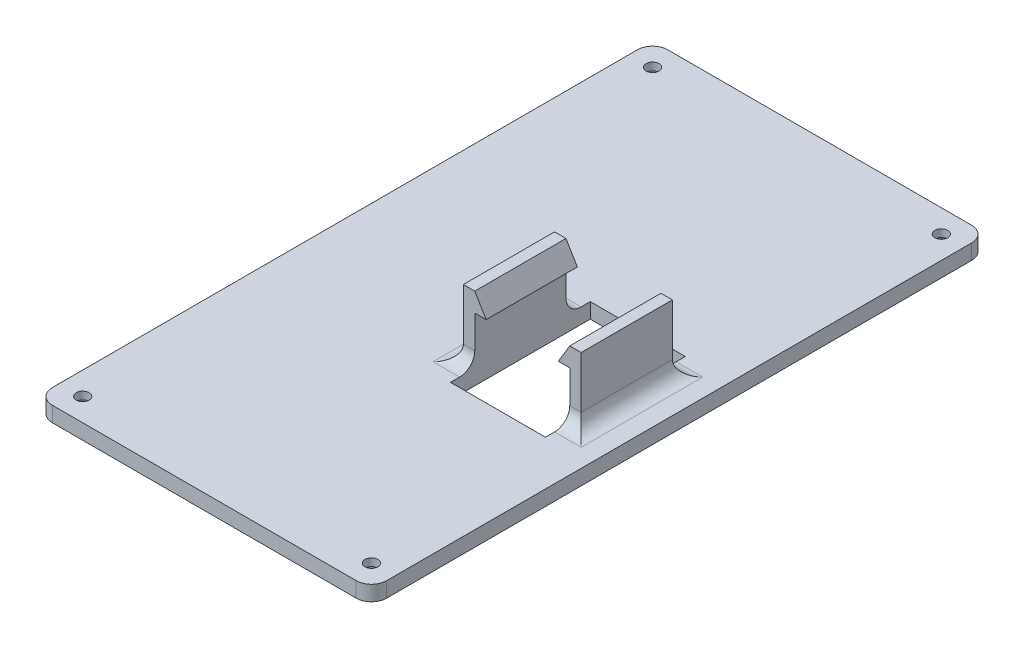
from build123d import *

# Parameters (mm, degrees)
SKETCH_1_W          = 44
SKETCH_1_H          = 81
EXTRUDE_1_DEPTH     = 2
SKETCH_12_W         = 12.5
SKETCH_12_H         = 18.4
CUT_EXTRUDE_3_DEPTH = 7.5
SKETCH_15_W         = 1.5
SKETCH_15_H         = 12
EXTRUDE_10_DEPTH    = 8.8
EXTRUDE_11_DEPTH    = 12
EXTRUDE_12_DEPTH    = 12
FILLET_2_R          = 2
FILLET_3_R          = 2
SKETCH_19_R         = 0.85
CUT_EXTRUDE_4_DEPTH = 12
SKETCH_20_R         = 2
CUT_EXTRUDE_5_DEPTH = 1


with BuildPart() as part:
    # 草图1 → 凸台-拉伸1 (new body)
    with BuildSketch(Plane(origin=(0, 0, 0), x_dir=(1, 0, 0), z_dir=(0, 1, 0))):
        with Locations((0, 2.5)):
            Rectangle(SKETCH_1_W, SKETCH_1_H)
    extrude(amount=EXTRUDE_1_DEPTH)

    # 草图12 → 切除-拉伸3 (cut)
    with BuildSketch(Plane.XZ):
        with Locations((9.849848709, 0)):
            Rectangle(SKETCH_12_W, SKETCH_12_H)
    extrude(amount=-CUT_EXTRUDE_3_DEPTH, mode=Mode.SUBTRACT)

    # 草图15 → 凸台-拉伸10 (add)
    with BuildSketch(Plane(origin=(0, 2, 0), x_dir=(1, 0, 0), z_dir=(0, 1, 0))):
        with Locations((2.849848709, 0)):
            Rectangle(SKETCH_15_W, SKETCH_15_H)
        with Locations((16.849848709, 0)):
            Rectangle(SKETCH_15_W, SKETCH_15_H)
    extrude(amount=EXTRUDE_10_DEPTH)

    # 草图16 → 凸台-拉伸11 (add)
    with BuildSketch(Plane.XY.offset(6)):
        Polygon((3.599848709, 10.8), (5.099848709, 8.3), (3.599848709, 8.3), align=None)
    extrude(amount=-EXTRUDE_11_DEPTH)

    # 草图18 → 凸台-拉伸12 (add)
    with BuildSketch(Plane.XY.offset(6)):
        Polygon((16.099848709, 10.8), (14.599848709, 8.3), (16.099848709, 8.3), align=None)
    extrude(amount=-EXTRUDE_12_DEPTH)

    # 圆角2
    fillet_2_edges = [part.edges().sort_by_distance(p)[0] for p in [
        (2.849848709, 2, -6),
        (2.099848709, 2, 0),
        (2.849848709, 2, 6),
        (16.849848709, 2, -6),
        (16.849848709, 2, 6),
        (17.599848709, 2, 0),
    ]]
    fillet(fillet_2_edges, radius=FILLET_2_R)

    # 圆角3
    fillet_3_edges = [part.edges().sort_by_distance(p)[0] for p in [
        (-22, 1, -43),
        (22, 1, -43),
        (22, 1, 38),
        (-22, 1, 38),
    ]]
    fillet(fillet_3_edges, radius=FILLET_3_R)

    # 草图19 → 切除-拉伸4 (cut)
    with BuildSketch(Plane(origin=(0, 2, 0), x_dir=(1, 0, 0), z_dir=(0, 1, 0))):
        with Locations(Location((-19, 40, 0), (0, 0, 270))):
            Circle(SKETCH_19_R)
        with Locations(Location((19, 40, 0), (0, 0, 270))):
            Circle(SKETCH_19_R)
        with Locations(Location((19, -35, 0), (0, 0, 270))):
            Circle(SKETCH_19_R)
        with Locations(Location((-19, -35, 0), (0, 0, 270))):
            Circle(SKETCH_19_R)
    extrude(amount=-CUT_EXTRUDE_4_DEPTH, mode=Mode.SUBTRACT)

    # 草图20 → 切除-拉伸5 (cut)
    with BuildSketch(Plane.XZ):
        with Locations(Location((-19, 35, 0), (0, 0, 270))):
            Circle(SKETCH_20_R)
        with Locations(Location((19, 35, 0), (0, 0, 270))):
            Circle(SKETCH_20_R)
        with Locations(Location((-19, -40, 0), (0, 0, 270))):
            Circle(SKETCH_20_R)
        with Locations(Location((19, -40, 0), (0, 0, 270))):
            Circle(SKETCH_20_R)
    extrude(amount=-CUT_EXTRUDE_5_DEPTH, mode=Mode.SUBTRACT)


solid = part.part
